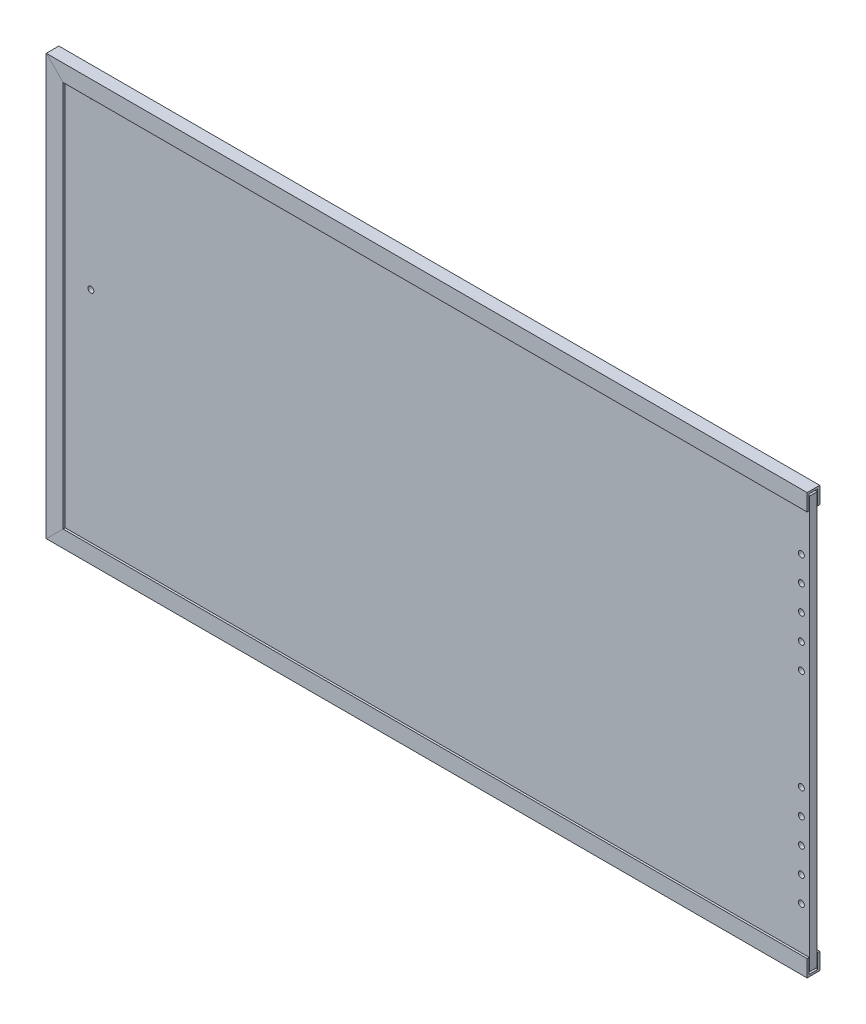
from build123d import *

# Parameters (mm, degrees)
SKETCH2_W                             = 574.675
SKETCH2_H                             = 317.5
FRAME_OUTER_DIMENSIONS_DEPTH          = 4.7625
SKETCH3_W                             = 561.975
SKETCH3_H                             = 292.1
FRAME_INNER_DIMENSIONS_DEPTH          = 654.379206989
FRAME_PROFILE_DEPTH                   = 3.175
FRAME_PROFILE_DEPTH_BACK              = 3.175
SKETCH4_W                             = 573.0875
SKETCH4_H                             = 314.325
FRAME_SECTION_SPLIT_SURFACE_1_1_BACK  = 657.619
FRAME_SECTION_SPLIT_SURFACE_1_1_DEPTH = 1315.238
FRAME_SECTION_SPLIT_SURFACE_1_2_BACK  = 657.619
FRAME_SECTION_SPLIT_SURFACE_1_2_DEPTH = 1315.238
FRAME_SECTION_SPLIT_SURFACE_2_3_BACK  = 657.619
FRAME_SECTION_SPLIT_SURFACE_2_3_DEPTH = 1315.238
FRAME_SECTION_SPLIT_SURFACE_2_4_BACK  = 657.619
FRAME_SECTION_SPLIT_SURFACE_2_4_DEPTH = 1315.238
SKETCH5_W                             = 571.5
SKETCH5_H                             = 311.15
DOOR_PANEL_DEPTH                      = 2.794
SKETCH9_W                             = 2.2479
SKETCH9_H                             = 7.5565
F_8_CLEARANCE_HOLE1_AT_2_COUNT        = 2
F_8_CLEARANCE_HOLE1_AT_2_PITCH        = 19.05
F_8_CLEARANCE_HOLE1_AT_3_COUNT        = 2
F_8_CLEARANCE_HOLE1_AT_3_PITCH        = 38.1
F_8_CLEARANCE_HOLE1_AT_4_COUNT        = 2
F_8_CLEARANCE_HOLE1_AT_4_PITCH        = 57.15
F_8_CLEARANCE_HOLE1_AT_5_COUNT        = 2
F_8_CLEARANCE_HOLE1_AT_5_PITCH        = 76.2
F_8_CLEARANCE_HOLE1_AT_6_COUNT        = 2
F_8_CLEARANCE_HOLE1_AT_6_PITCH        = 171.45
F_8_CLEARANCE_HOLE1_AT_7_COUNT        = 2
F_8_CLEARANCE_HOLE1_AT_7_PITCH        = 190.5
F_8_CLEARANCE_HOLE1_AT_8_COUNT        = 2
F_8_CLEARANCE_HOLE1_AT_8_PITCH        = 209.55
F_8_CLEARANCE_HOLE1_AT_9_COUNT        = 2
F_8_CLEARANCE_HOLE1_AT_9_PITCH        = 228.6
F_8_CLEARANCE_HOLE1_AT_10_COUNT       = 2
F_8_CLEARANCE_HOLE1_AT_10_PITCH       = 152.4
SKETCH12_W                            = 2.2479
SKETCH12_H                            = 7.5565
F_8_CLEARANCE_HOLE2_AT_2_COUNT        = 2
F_8_CLEARANCE_HOLE2_AT_2_PITCH        = 127


with BuildPart() as part:
    # Sketch2 → Frame outer dimensions (new, symmetric)
    with BuildSketch(Plane.XY):
        with Locations((290.5125, 146.05)):
            Rectangle(SKETCH2_W, SKETCH2_H)
    extrude(amount=FRAME_OUTER_DIMENSIONS_DEPTH, both=True)

    # Sketch3 → Frame inner dimensions (cut, through all)
    with BuildSketch(Plane.XY.offset(4.7625)):
        with Locations((296.8625, 146.05)):
            Rectangle(SKETCH3_W, SKETCH3_H)
    extrude(amount=-FRAME_INNER_DIMENSIONS_DEPTH, mode=Mode.SUBTRACT)

    # Sketch4 → Frame profile (cut, two sides: drawn at the far end of the back side and taken through both)
    with BuildSketch(Plane.XY.offset(-FRAME_PROFILE_DEPTH_BACK)):
        with Locations((291.30625, 146.05)):
            Rectangle(SKETCH4_W, SKETCH4_H)
    extrude(amount=FRAME_PROFILE_DEPTH + FRAME_PROFILE_DEPTH_BACK, mode=Mode.SUBTRACT)


with BuildPart() as body_2:
    # Frame section split: the piece behind the surface
    add(part.part)
    # Frame section split surface 1: a surface, the sketch's curves swept straight by 1315.238 mm
    with BuildLine(Plane.XY.offset(4.7625).offset(-FRAME_SECTION_SPLIT_SURFACE_1_1_BACK), mode=Mode.PRIVATE) as frame_section_split_surface_1_1_path:
        Line((3.175, 304.8), (15.875, 292.1))
    frame_section_split_surface_1_1 = Shell.extrude(frame_section_split_surface_1_1_path.wire(), (0 * FRAME_SECTION_SPLIT_SURFACE_1_1_DEPTH, 0 * FRAME_SECTION_SPLIT_SURFACE_1_1_DEPTH, 1 * FRAME_SECTION_SPLIT_SURFACE_1_1_DEPTH))
    split(bisect_by=frame_section_split_surface_1_1, keep=Keep.BOTTOM)


with BuildPart() as part_1:
    add(part.part)

    # Frame section split: split by a surface, the side it looks to stays
    # Frame section split surface 1: a surface, the sketch's curves swept straight by 1315.238 mm
    with BuildLine(Plane.XY.offset(4.7625).offset(-FRAME_SECTION_SPLIT_SURFACE_1_2_BACK), mode=Mode.PRIVATE) as frame_section_split_surface_1_2_path:
        Line((3.175, 304.8), (15.875, 292.1))
    frame_section_split_surface_1_2 = Shell.extrude(frame_section_split_surface_1_2_path.wire(), (0 * FRAME_SECTION_SPLIT_SURFACE_1_2_DEPTH, 0 * FRAME_SECTION_SPLIT_SURFACE_1_2_DEPTH, 1 * FRAME_SECTION_SPLIT_SURFACE_1_2_DEPTH))
    split(bisect_by=frame_section_split_surface_1_2, keep=Keep.TOP)


with BuildPart() as body_3:
    # Frame section split 2 body 2: the piece behind the surface
    add(body_2.part)
    # Frame section split surface 2: a surface, the sketch's curves swept straight by 1315.238 mm
    with BuildLine(Plane.XY.offset(4.7625).offset(-FRAME_SECTION_SPLIT_SURFACE_2_3_BACK), mode=Mode.PRIVATE) as frame_section_split_surface_2_3_path:
        Line((3.175, -12.7), (15.875, 0))
    frame_section_split_surface_2_3 = Shell.extrude(frame_section_split_surface_2_3_path.wire(), (0 * FRAME_SECTION_SPLIT_SURFACE_2_3_DEPTH, 0 * FRAME_SECTION_SPLIT_SURFACE_2_3_DEPTH, 1 * FRAME_SECTION_SPLIT_SURFACE_2_3_DEPTH))
    split(bisect_by=frame_section_split_surface_2_3, keep=Keep.BOTTOM)


with BuildPart() as body_2_1:
    add(body_2.part)

    # Frame section split 2 body 2: split by a surface, the side it looks to stays
    # Frame section split surface 2: a surface, the sketch's curves swept straight by 1315.238 mm
    with BuildLine(Plane.XY.offset(4.7625).offset(-FRAME_SECTION_SPLIT_SURFACE_2_4_BACK), mode=Mode.PRIVATE) as frame_section_split_surface_2_4_path:
        Line((3.175, -12.7), (15.875, 0))
    frame_section_split_surface_2_4 = Shell.extrude(frame_section_split_surface_2_4_path.wire(), (0 * FRAME_SECTION_SPLIT_SURFACE_2_4_DEPTH, 0 * FRAME_SECTION_SPLIT_SURFACE_2_4_DEPTH, 1 * FRAME_SECTION_SPLIT_SURFACE_2_4_DEPTH))
    split(bisect_by=frame_section_split_surface_2_4, keep=Keep.TOP)


with BuildPart() as body_4:
    # Sketch5 → Door panel (new, symmetric)
    with BuildSketch(Plane.XY):
        with Locations((292.1, 146.05)):
            Rectangle(SKETCH5_W, SKETCH5_H)
    extrude(amount=DOOR_PANEL_DEPTH, both=True)

    # Sketch9 → #8 Clearance Hole1 (revolve, cut)
    with BuildSketch(Plane(origin=(571.5, 31.75, 2.794), x_dir=(0, -1, 0), z_dir=(1, 0, 0))):
        with Locations((1.12395, 3.77825)):
            Rectangle(SKETCH9_W, SKETCH9_H)
    f_8_clearance_hole1 = revolve(axis=Axis((571.5, 31.75, 9.144), (0, 0, -1)), mode=Mode.SUBTRACT)

    # #8 Clearance Hole1 at 2: #8 Clearance Hole1 ×2
    with Locations(*[(0, i * F_8_CLEARANCE_HOLE1_AT_2_PITCH, 0) for i in range(1, F_8_CLEARANCE_HOLE1_AT_2_COUNT)]):
        add(f_8_clearance_hole1, mode=Mode.SUBTRACT)

    # #8 Clearance Hole1 at 3: #8 Clearance Hole1 ×2
    with Locations(*[(0, i * F_8_CLEARANCE_HOLE1_AT_3_PITCH, 0) for i in range(1, F_8_CLEARANCE_HOLE1_AT_3_COUNT)]):
        add(f_8_clearance_hole1, mode=Mode.SUBTRACT)

    # #8 Clearance Hole1 at 4: #8 Clearance Hole1 ×2
    with Locations(*[(0, i * F_8_CLEARANCE_HOLE1_AT_4_PITCH, 0) for i in range(1, F_8_CLEARANCE_HOLE1_AT_4_COUNT)]):
        add(f_8_clearance_hole1, mode=Mode.SUBTRACT)

    # #8 Clearance Hole1 at 5: #8 Clearance Hole1 ×2
    with Locations(*[(0, i * F_8_CLEARANCE_HOLE1_AT_5_PITCH, 0) for i in range(1, F_8_CLEARANCE_HOLE1_AT_5_COUNT)]):
        add(f_8_clearance_hole1, mode=Mode.SUBTRACT)

    # #8 Clearance Hole1 at 6: #8 Clearance Hole1 ×2
    with Locations(*[(0, i * F_8_CLEARANCE_HOLE1_AT_6_PITCH, 0) for i in range(1, F_8_CLEARANCE_HOLE1_AT_6_COUNT)]):
        add(f_8_clearance_hole1, mode=Mode.SUBTRACT)

    # #8 Clearance Hole1 at 7: #8 Clearance Hole1 ×2
    with Locations(*[(0, i * F_8_CLEARANCE_HOLE1_AT_7_PITCH, 0) for i in range(1, F_8_CLEARANCE_HOLE1_AT_7_COUNT)]):
        add(f_8_clearance_hole1, mode=Mode.SUBTRACT)

    # #8 Clearance Hole1 at 8: #8 Clearance Hole1 ×2
    with Locations(*[(0, i * F_8_CLEARANCE_HOLE1_AT_8_PITCH, 0) for i in range(1, F_8_CLEARANCE_HOLE1_AT_8_COUNT)]):
        add(f_8_clearance_hole1, mode=Mode.SUBTRACT)

    # #8 Clearance Hole1 at 9: #8 Clearance Hole1 ×2
    with Locations(*[(0, i * F_8_CLEARANCE_HOLE1_AT_9_PITCH, 0) for i in range(1, F_8_CLEARANCE_HOLE1_AT_9_COUNT)]):
        add(f_8_clearance_hole1, mode=Mode.SUBTRACT)

    # #8 Clearance Hole1 at 10: #8 Clearance Hole1 ×2
    with Locations(*[(0, i * F_8_CLEARANCE_HOLE1_AT_10_PITCH, 0) for i in range(1, F_8_CLEARANCE_HOLE1_AT_10_COUNT)]):
        add(f_8_clearance_hole1, mode=Mode.SUBTRACT)

    # Sketch12 → #8 Clearance Hole2 (revolve, cut)
    with BuildSketch(Plane(origin=(34.925, 292.1, 2.794), x_dir=(0, -1, 0), z_dir=(1, 0, 0))):
        with Locations((1.12395, 3.77825)):
            Rectangle(SKETCH12_W, SKETCH12_H)
    f_8_clearance_hole2 = revolve(axis=Axis((34.925, 292.1, 9.144), (0, 0, -1)), mode=Mode.SUBTRACT)

    # #8 Clearance Hole2 at 2: #8 Clearance Hole2 ×2
    with Locations(*[(0, -i * F_8_CLEARANCE_HOLE2_AT_2_PITCH, 0) for i in range(1, F_8_CLEARANCE_HOLE2_AT_2_COUNT)]):
        add(f_8_clearance_hole2, mode=Mode.SUBTRACT)


with BuildPart() as body_5:
    # Mirror1: mirrored copy
    add(part_1.part.mirror(Plane(origin=(0, 0, 0), x_dir=(0, 0, 1), z_dir=(1, 0, 0))))


with BuildPart() as body_6:
    # Mirror1 2: mirrored copy
    add(body_2_1.part.mirror(Plane(origin=(0, 0, 0), x_dir=(0, 0, 1), z_dir=(1, 0, 0))))


with BuildPart() as body_7:
    # Mirror1 3: mirrored copy
    add(body_3.part.mirror(Plane(origin=(0, 0, 0), x_dir=(0, 0, 1), z_dir=(1, 0, 0))))


with BuildPart() as body_8:
    # Mirror1 4: mirrored copy
    add(body_4.part.mirror(Plane(origin=(0, 0, 0), x_dir=(0, 0, 1), z_dir=(1, 0, 0))))


solid = Compound([part_1.part, body_3.part, body_2_1.part, body_4.part])
